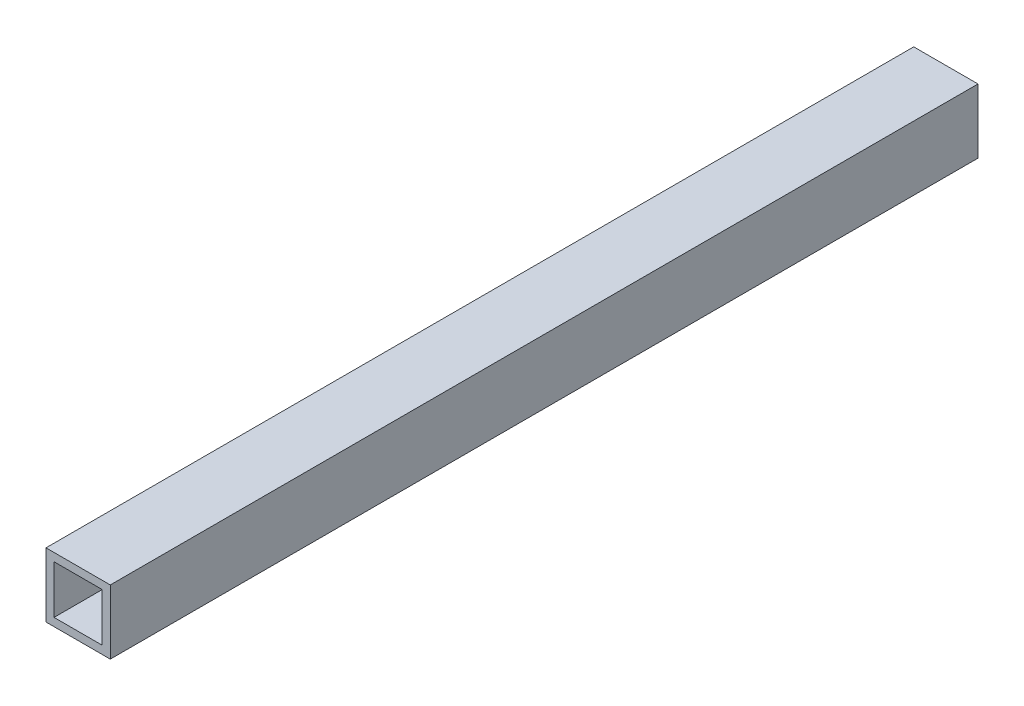
from build123d import *

# Parameters (mm, degrees)
SKETCH1_W           = 25.4
SKETCH1_H           = 25.4
SKETCH1_W_2         = 19.05
SKETCH1_H_2         = 19.05
BOSS_EXTRUDE1_DEPTH = 342.9


with BuildPart() as part:
    # Sketch1 → Boss-Extrude1 (new body)
    with BuildSketch(Plane.XY):
        with Locations((12.7, 12.7)):
            Rectangle(SKETCH1_W, SKETCH1_H)
        with Locations((12.7, 12.7)):
            Rectangle(SKETCH1_W_2, SKETCH1_H_2, mode=Mode.SUBTRACT)
    extrude(amount=BOSS_EXTRUDE1_DEPTH)


solid = part.part
